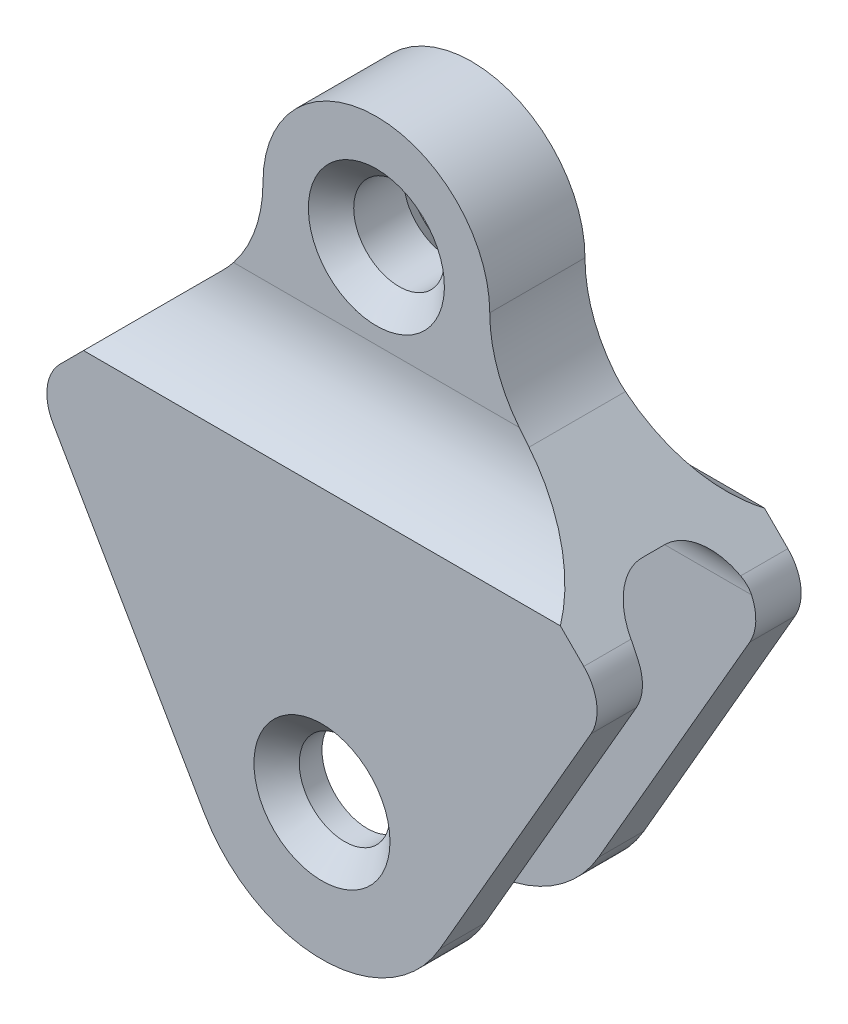
from build123d import *

# Parameters (mm, degrees)
SKETCH1_R               = 10
BOSS_EXTRUDE1_DEPTH     = 22.5
CUT_EXTRUDE1_DEPTH      = 141.755212167
CUT_EXTRUDE1_DEPTH_BACK = 141.755212167
CHAMFER1_SIZE           = 5


with BuildPart() as part:
    # Sketch1 → Boss-Extrude1 (new, symmetric)
    with BuildSketch(Plane.XY):
        with BuildLine():
            Line((-57.740497942, 54.833095187), (-33.786796564, 78.786796564))
            ThreePointArc((-33.786796564, 78.786796564), (-27.283614025, 88.519497029), (-25, 100))
            ThreePointArc((-25, 100), (0, 125), (25, 100))
            ThreePointArc((25, 100), (27.283614025, 88.519497029), (33.786796564, 78.786796564))
            Line((33.786796564, 78.786796564), (57.740497942, 54.833095187))
            ThreePointArc((57.740497942, 54.833095187), (60.583878744, 49.067289298), (59.329684168, 42.762027375))
            Line((59.329684168, 42.762027375), (25.980762114, -15))
            ThreePointArc((25.980762114, -15), (0, -30), (-25.980762114, -15))
            Line((-25.980762114, -15), (-59.329684168, 42.762027375))
            ThreePointArc((-59.329684168, 42.762027375), (-60.583878744, 49.067289298), (-57.740497942, 54.833095187))
        make_face()
        with Locations(Location((0, 0, 0), (0, 0, 180))):
            Circle(SKETCH1_R, mode=Mode.SUBTRACT)
        with Locations(Location((0, 100, 0), (0, 0, 180))):
            Circle(SKETCH1_R, mode=Mode.SUBTRACT)
    extrude(amount=BOSS_EXTRUDE1_DEPTH, both=True)

    # Sketch2 → Cut-Extrude1 (cut, two sides: drawn at the far end of the back side and taken through both)
    with BuildSketch(Plane(origin=(0, 0, 0), x_dir=(0, 0, -1), z_dir=(1, 0, 0)).offset(-CUT_EXTRUDE1_DEPTH_BACK)):
        with BuildLine():
            Line((-2.5, 62), (2.5, 62))
            ThreePointArc((2.5, 62), (9.571067812, 59.071067812), (12.5, 52))
            Line((12.5, 52), (12.5, -62))
            Line((12.5, -62), (-12.5, -62))
            Line((-12.5, -62), (-12.5, 52))
            ThreePointArc((-12.5, 52), (-9.571067812, 59.071067812), (-2.5, 62))
        make_face()
        with BuildLine():
            Line((-22.5, 125), (-10.5, 125))
            Line((-10.5, 125), (-10.5, 81.354156504))
            ThreePointArc((-10.5, 81.354156504), (-13.705505282, 69.10670779), (-22.5, 60))
            Line((-22.5, 60), (-22.5, 125))
        make_face()
        with BuildLine():
            Line((22.5, 60), (22.5, 125))
            Line((22.5, 125), (10.5, 125))
            Line((10.5, 125), (10.5, 81.354156504))
            ThreePointArc((10.5, 81.354156504), (13.705505282, 69.10670779), (22.5, 60))
        make_face()
    extrude(amount=CUT_EXTRUDE1_DEPTH + CUT_EXTRUDE1_DEPTH_BACK, mode=Mode.SUBTRACT)

    # Chamfer1
    chamfer1_edges = [part.edges().sort_by_distance(p)[0] for p in [
        (10, 0, -22.5),
        (10, 100, -10.5),
        (10, 0, 22.5),
        (10, 100, 10.5),
    ]]
    chamfer(chamfer1_edges, length=CHAMFER1_SIZE)


solid = part.part
